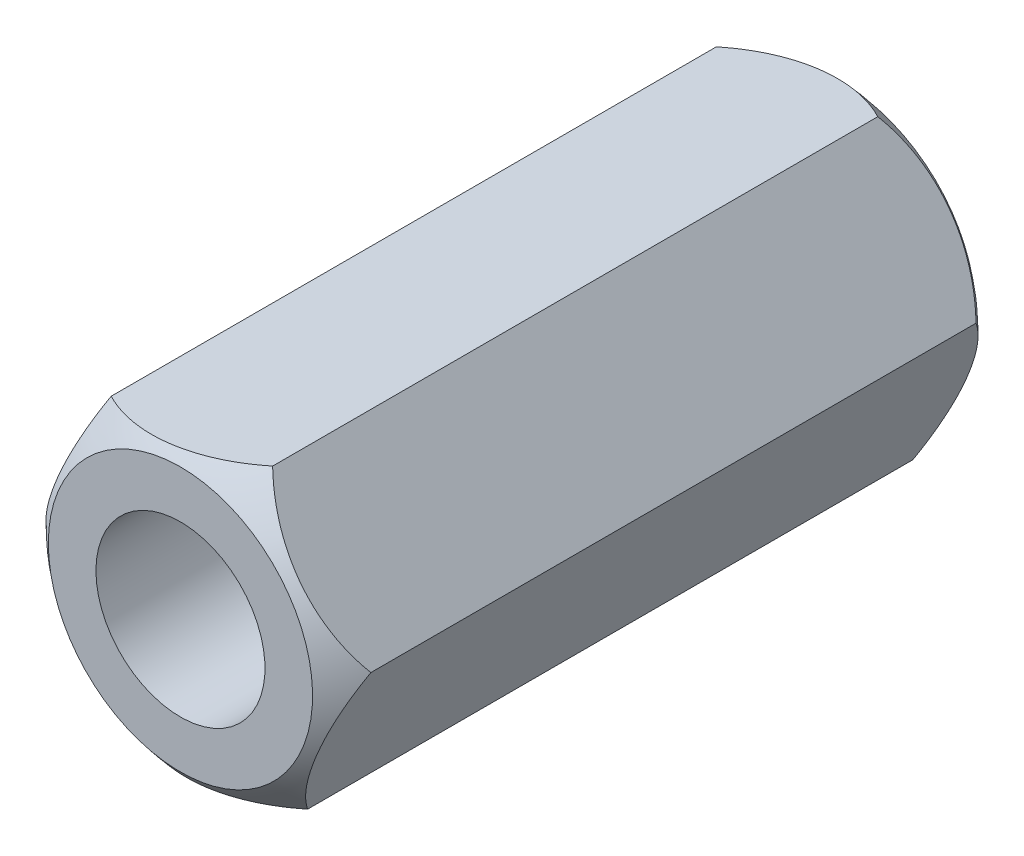
from build123d import *

# Parameters (mm, degrees)
EXTRUSION1_DEPTH   = 40
TROU_TARAUD_M121_D = 10.2


with BuildPart() as part:
    # Esquisse1 → Extrusion1 (new body)
    with BuildSketch(Plane.XY):
        Polygon((3.813132395, 9.043967861), (-5.925739721, 7.824253453), (-9.738872116, -1.219714408), (-3.813132395, -9.043967861), (5.925739721, -7.824253453), (9.738872116, 1.219714408), align=None)
    extrude(amount=EXTRUSION1_DEPTH)

    # Trou taraudé M121 (through all)
    with Locations(Plane(origin=(0, 0, 0), x_dir=(-1, 0, 0), z_dir=(0, 0, -1))):
        with Locations((0, 0)):
            Hole(TROU_TARAUD_M121_D / 2)

    # Esquisse5 → Enlèvement de matière-Révolution1 (revolve, cut)
    with BuildSketch(Plane(origin=(0, 0, 0), x_dir=(1, 0, 0), z_dir=(0, 1, 0)), mode=Mode.PRIVATE) as enl_vement_de_mati_re_r_volution1_sk:
        with BuildLine():
            Line((0, 7.38932546), (0, 2.731180457))
            ThreePointArc((0, 2.731180457), (9.188017929, -1.07462118), (12.993819567, -10.26263911))
            Line((12.993819567, -10.26263911), (12.993819567, 7.38932546))
            Line((12.993819567, 7.38932546), (0, 7.38932546))
        make_face()
        with BuildLine():
            Line((12.993819567, -47.38932546), (12.993819567, -29.73736089))
            ThreePointArc((12.993819567, -29.73736089), (9.188017929, -38.92537882), (0, -42.731180457))
            Line((0, -42.731180457), (0, -47.38932546))
            Line((0, -47.38932546), (12.993819567, -47.38932546))
        make_face()
    revolve(enl_vement_de_mati_re_r_volution1_sk.sketch.rotate(Axis((0, 0, 10.26263911), (0, 0, -1)), 352.861339984), axis=Axis((0, 0, 10.26263911), (0, 0, -1)), mode=Mode.SUBTRACT)


solid = part.part
